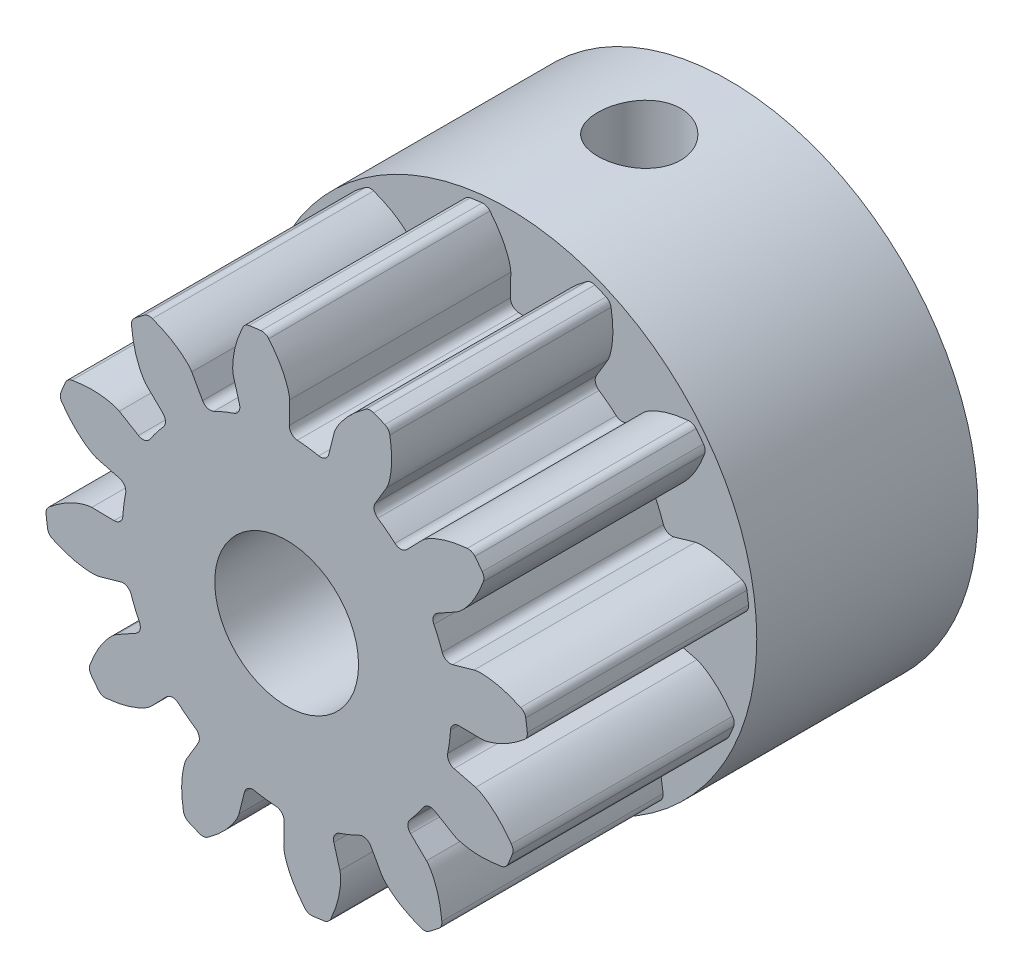
from build123d import *

# Parameters (mm, degrees)
EXTRUDE_1_DEPTH                 = 8
SKETCH_2_R                      = 9
EXTRUDE_2_DEPTH                 = 8
SKETCH_3_R                      = 2.6
CUT_EXTRUDE_1_DEPTH             = 21.445048388
SKETCH_4_W                      = 5.6
SKETCH_4_H                      = 2.6
CUT_EXTRUDE_2_DEPTH             = 6.5
CUT_EXTRUDE_3_REACH             = 19.501
SKETCH_5_R                      = 1.5
CUT_EXTRUDE_3_DIRECTION_2_DEPTH = 18.50114299


with BuildPart() as part:
    # 草图1 → 凸台-拉伸1 (new body)
    with BuildSketch(Plane.XY):
        with BuildLine():
            Line((1.721923819, 6.834104062), (1.525117566, 6.053004226))
            ThreePointArc((1.525117566, 6.053004226), (1.389032317, 5.865185287), (1.160983915, 5.822887823))
            ThreePointArc((1.160983915, 5.822887823), (0.968517342, 5.857975794), (0.774999266, 5.886703864))
            ThreePointArc((0.774999266, 5.886703864), (0.580639788, 5.909040843), (0.385649919, 5.92496248))
            ThreePointArc((0.385649919, 5.92496248), (0.176319467, 6.024841963), (0.093482328, 6.241482581))
            Line((0.093482328, 6.241482581), (0.105545599, 7.046904291))
            add(Edge.make_bspline(
                [(-0.649249674, 8.585993084), (-0.541014516, 8.451424341), (-0.326461552, 8.174265446), (-0.09406722, 7.754050995), (0.041682677, 7.397285398), (0.096816454, 7.173786834), (0.10379949, 7.072284874), (0.105545599, 7.046904291)],
                knots=[0.168803506, 0.168803506, 0.168803506, 0.168803506, 0.686224826, 1.219956542, 1.601195732, 1.829944144, 1.906214021, 1.906214021, 1.906214021, 1.906214021], degree=3))
            ThreePointArc((-0.649249674, 8.585993084), (-0.772877087, 8.678727408), (-0.925823343, 8.700882205))
            ThreePointArc((-0.925823343, 8.700882205), (-1.142104182, 8.675142537), (-1.357677346, 8.644027546))
            ThreePointArc((-1.357677346, 8.644027546), (-1.499678001, 8.583042252), (-1.595091504, 8.461470645))
            add(Edge.make_bspline(
                [(-1.595091504, 8.461470645), (-1.664809685, 8.3034739), (-1.800317933, 7.980228573), (-1.916034117, 7.514184503), (-1.954820718, 7.134440739), (-1.950230172, 6.904288033), (-1.930704626, 6.804437326), (-1.92582226, 6.779469639)],
                knots=[0.168803506, 0.168803506, 0.168803506, 0.168803506, 0.686224826, 1.219956542, 1.601195732, 1.829944144, 1.906214021, 1.906214021, 1.906214021, 1.906214021], degree=3))
            Line((-1.92582226, 6.779469639), (-1.705711557, 6.004614212))
            ThreePointArc((-1.705711557, 6.004614212), (-1.729655371, 5.773915615), (-1.906002348, 5.623260736))
            ThreePointArc((-1.906002348, 5.623260736), (-2.090227275, 5.557414524), (-2.27218288, 5.485534724))
            ThreePointArc((-2.27218288, 5.485534724), (-2.451671615, 5.407699376), (-2.628498613, 5.323992984))
            ThreePointArc((-2.628498613, 5.323992984), (-2.859723843, 5.305825927), (-3.039783219, 5.452023636))
            Line((-3.039783219, 5.452023636), (-3.432046975, 6.155570934))
            add(Edge.make_bspline(
                [(-4.855263253, 7.111063291), (-4.694244485, 7.04864092), (-4.369856721, 6.915890758), (-3.9584901, 6.668171534), (-3.662544441, 6.427078412), (-3.503047908, 6.261089867), (-3.446249442, 6.176678109), (-3.432046975, 6.155570934)],
                knots=[0.168803506, 0.168803506, 0.168803506, 0.168803506, 0.686224826, 1.219956542, 1.601195732, 1.829944144, 1.906214021, 1.906214021, 1.906214021, 1.906214021], degree=3))
            ThreePointArc((-4.855263253, 7.111063291), (-5.008694895, 7.129559864), (-5.152227636, 7.072273353))
            ThreePointArc((-5.152227636, 7.072273353), (-5.326662504, 6.941841728), (-5.497796845, 6.807108773))
            ThreePointArc((-5.497796845, 6.807108773), (-5.590280373, 6.683293632), (-5.612125086, 6.53030278))
            add(Edge.make_bspline(
                [(-5.612125086, 6.53030278), (-5.593504429, 6.358614495), (-5.549235351, 6.010921706), (-5.416426471, 5.54945761), (-5.260144771, 5.201196563), (-5.141092888, 5.004173746), (-5.074257916, 4.92746327), (-5.05754582, 4.908281802)],
                knots=[0.168803506, 0.168803506, 0.168803506, 0.168803506, 0.686224826, 1.219956542, 1.601195732, 1.829944144, 1.906214021, 1.906214021, 1.906214021, 1.906214021], degree=3))
            Line((-5.05754582, 4.908281802), (-4.479496646, 4.347292669))
            ThreePointArc((-4.479496646, 4.347292669), (-4.384883298, 4.135529916), (-4.462276821, 3.916885475))
            ThreePointArc((-4.462276821, 3.916885475), (-4.588897182, 3.767748519), (-4.710535458, 3.614520985))
            ThreePointArc((-4.710535458, 3.614520985), (-4.827059588, 3.457369228), (-4.938343065, 3.296463867))
            ThreePointArc((-4.938343065, 3.296463867), (-5.12950646, 3.165118119), (-5.358541308, 3.201699361))
            Line((-5.358541308, 3.201699361), (-6.050025334, 3.614857316))
            add(Edge.make_bspline(
                [(-7.760312965, 3.730729831), (-7.589655435, 3.757179856), (-7.24235231, 3.804408726), (-6.762238754, 3.795560895), (-6.385395735, 3.734740956), (-6.164273412, 3.670738926), (-6.072878619, 3.626035432), (-6.050025334, 3.614857316)],
                knots=[0.168803506, 0.168803506, 0.168803506, 0.168803506, 0.686224826, 1.219956542, 1.601195732, 1.829944144, 1.906214021, 1.906214021, 1.906214021, 1.906214021], degree=3))
            ThreePointArc((-7.760312965, 3.730729831), (-7.902436951, 3.670032512), (-7.998096696, 3.548654568))
            ThreePointArc((-7.998096696, 3.548654568), (-8.083945909, 3.348480033), (-8.164786119, 3.146230701))
            ThreePointArc((-8.164786119, 3.146230701), (-8.182971633, 2.992761879), (-8.125394284, 2.849345559))
            add(Edge.make_bspline(
                [(-8.125394284, 2.849345559), (-8.02342418, 2.709969471), (-7.811239638, 2.430993222), (-7.465491726, 2.097758032), (-7.156017281, 1.874295968), (-6.954403917, 1.763195144), (-6.858167896, 1.73017941), (-6.834104062, 1.721923819)],
                knots=[0.168803506, 0.168803506, 0.168803506, 0.168803506, 0.686224826, 1.219956542, 1.601195732, 1.829944144, 1.906214021, 1.906214021, 1.906214021, 1.906214021], degree=3))
            Line((-6.834104062, 1.721923819), (-6.053004226, 1.525117566))
            ThreePointArc((-6.053004226, 1.525117566), (-5.865185287, 1.389032317), (-5.822887823, 1.160983915))
            ThreePointArc((-5.822887823, 1.160983915), (-5.857975794, 0.968517342), (-5.886703864, 0.774999266))
            ThreePointArc((-5.886703864, 0.774999266), (-5.909040843, 0.580639788), (-5.92496248, 0.385649919))
            ThreePointArc((-5.92496248, 0.385649919), (-6.024841963, 0.176319467), (-6.241482581, 0.093482328))
            Line((-6.241482581, 0.093482328), (-7.046904291, 0.105545599))
            add(Edge.make_bspline(
                [(-8.585993084, -0.649249674), (-8.451424341, -0.541014516), (-8.174265446, -0.326461552), (-7.754050995, -0.09406722), (-7.397285398, 0.041682677), (-7.173786834, 0.096816454), (-7.072284874, 0.10379949), (-7.046904291, 0.105545599)],
                knots=[0.168803506, 0.168803506, 0.168803506, 0.168803506, 0.686224826, 1.219956542, 1.601195732, 1.829944144, 1.906214021, 1.906214021, 1.906214021, 1.906214021], degree=3))
            ThreePointArc((-8.585993084, -0.649249674), (-8.678727408, -0.772877087), (-8.700882205, -0.925823343))
            ThreePointArc((-8.700882205, -0.925823343), (-8.675142537, -1.142104182), (-8.644027546, -1.357677346))
            ThreePointArc((-8.644027546, -1.357677346), (-8.583042252, -1.499678001), (-8.461470645, -1.595091504))
            add(Edge.make_bspline(
                [(-8.461470645, -1.595091504), (-8.3034739, -1.664809685), (-7.980228573, -1.800317933), (-7.514184503, -1.916034117), (-7.134440739, -1.954820718), (-6.904288033, -1.950230172), (-6.804437326, -1.930704626), (-6.779469639, -1.92582226)],
                knots=[0.168803506, 0.168803506, 0.168803506, 0.168803506, 0.686224826, 1.219956542, 1.601195732, 1.829944144, 1.906214021, 1.906214021, 1.906214021, 1.906214021], degree=3))
            Line((-6.779469639, -1.92582226), (-6.004614212, -1.705711557))
            ThreePointArc((-6.004614212, -1.705711557), (-5.773915615, -1.729655371), (-5.623260736, -1.906002348))
            ThreePointArc((-5.623260736, -1.906002348), (-5.557414524, -2.090227275), (-5.485534724, -2.27218288))
            ThreePointArc((-5.485534724, -2.27218288), (-5.407699376, -2.451671615), (-5.323992984, -2.628498613))
            ThreePointArc((-5.323992984, -2.628498613), (-5.305825927, -2.859723843), (-5.452023636, -3.039783219))
            Line((-5.452023636, -3.039783219), (-6.155570934, -3.432046975))
            add(Edge.make_bspline(
                [(-7.111063291, -4.855263253), (-7.04864092, -4.694244485), (-6.915890758, -4.369856721), (-6.668171534, -3.9584901), (-6.427078412, -3.662544441), (-6.261089867, -3.503047908), (-6.176678109, -3.446249442), (-6.155570934, -3.432046975)],
                knots=[0.168803506, 0.168803506, 0.168803506, 0.168803506, 0.686224826, 1.219956542, 1.601195732, 1.829944144, 1.906214021, 1.906214021, 1.906214021, 1.906214021], degree=3))
            ThreePointArc((-7.111063291, -4.855263253), (-7.129559864, -5.008694895), (-7.072273353, -5.152227636))
            ThreePointArc((-7.072273353, -5.152227636), (-6.941841728, -5.326662504), (-6.807108773, -5.497796845))
            ThreePointArc((-6.807108773, -5.497796845), (-6.683293632, -5.590280373), (-6.53030278, -5.612125086))
            add(Edge.make_bspline(
                [(-6.53030278, -5.612125086), (-6.358614495, -5.593504429), (-6.010921706, -5.549235351), (-5.54945761, -5.416426471), (-5.201196563, -5.260144771), (-5.004173746, -5.141092888), (-4.92746327, -5.074257916), (-4.908281802, -5.05754582)],
                knots=[0.168803506, 0.168803506, 0.168803506, 0.168803506, 0.686224826, 1.219956542, 1.601195732, 1.829944144, 1.906214021, 1.906214021, 1.906214021, 1.906214021], degree=3))
            Line((-4.908281802, -5.05754582), (-4.347292669, -4.479496646))
            ThreePointArc((-4.347292669, -4.479496646), (-4.135529916, -4.384883298), (-3.916885475, -4.462276821))
            ThreePointArc((-3.916885475, -4.462276821), (-3.767748519, -4.588897182), (-3.614520985, -4.710535458))
            ThreePointArc((-3.614520985, -4.710535458), (-3.457369228, -4.827059588), (-3.296463867, -4.938343065))
            ThreePointArc((-3.296463867, -4.938343065), (-3.165118119, -5.12950646), (-3.201699361, -5.358541308))
            Line((-3.201699361, -5.358541308), (-3.614857316, -6.050025334))
            add(Edge.make_bspline(
                [(-3.730729831, -7.760312965), (-3.757179856, -7.589655435), (-3.804408726, -7.24235231), (-3.795560895, -6.762238754), (-3.734740956, -6.385395735), (-3.670738926, -6.164273412), (-3.626035432, -6.072878619), (-3.614857316, -6.050025334)],
                knots=[0.168803506, 0.168803506, 0.168803506, 0.168803506, 0.686224826, 1.219956542, 1.601195732, 1.829944144, 1.906214021, 1.906214021, 1.906214021, 1.906214021], degree=3))
            ThreePointArc((-3.730729831, -7.760312965), (-3.670032512, -7.902436951), (-3.548654568, -7.998096696))
            ThreePointArc((-3.548654568, -7.998096696), (-3.348480033, -8.083945909), (-3.146230701, -8.164786119))
            ThreePointArc((-3.146230701, -8.164786119), (-2.992761879, -8.182971633), (-2.849345559, -8.125394284))
            add(Edge.make_bspline(
                [(-2.849345559, -8.125394284), (-2.709969471, -8.02342418), (-2.430993222, -7.811239638), (-2.097758032, -7.465491726), (-1.874295968, -7.156017281), (-1.763195144, -6.954403917), (-1.73017941, -6.858167896), (-1.721923819, -6.834104062)],
                knots=[0.168803506, 0.168803506, 0.168803506, 0.168803506, 0.686224826, 1.219956542, 1.601195732, 1.829944144, 1.906214021, 1.906214021, 1.906214021, 1.906214021], degree=3))
            Line((-1.721923819, -6.834104062), (-1.525117566, -6.053004226))
            ThreePointArc((-1.525117566, -6.053004226), (-1.389032316, -5.865185287), (-1.160983915, -5.822887823))
            ThreePointArc((-1.160983915, -5.822887823), (-0.968517342, -5.857975794), (-0.774999266, -5.886703864))
            ThreePointArc((-0.774999266, -5.886703864), (-0.580639788, -5.909040843), (-0.385649919, -5.92496248))
            ThreePointArc((-0.385649919, -5.92496248), (-0.176319467, -6.024841963), (-0.093482328, -6.241482581))
            Line((-0.093482328, -6.241482581), (-0.105545599, -7.046904291))
            add(Edge.make_bspline(
                [(0.649249674, -8.585993084), (0.541014516, -8.451424341), (0.326461552, -8.174265446), (0.09406722, -7.754050995), (-0.041682677, -7.397285398), (-0.096816454, -7.173786834), (-0.10379949, -7.072284874), (-0.105545599, -7.046904291)],
                knots=[0.168803506, 0.168803506, 0.168803506, 0.168803506, 0.686224826, 1.219956542, 1.601195732, 1.829944144, 1.906214021, 1.906214021, 1.906214021, 1.906214021], degree=3))
            ThreePointArc((0.649249674, -8.585993084), (0.772877087, -8.678727408), (0.925823343, -8.700882205))
            ThreePointArc((0.925823343, -8.700882205), (1.142104182, -8.675142537), (1.357677346, -8.644027546))
            ThreePointArc((1.357677346, -8.644027546), (1.499678001, -8.583042252), (1.595091504, -8.461470645))
            add(Edge.make_bspline(
                [(1.595091504, -8.461470645), (1.664809685, -8.3034739), (1.800317933, -7.980228573), (1.916034117, -7.514184503), (1.954820718, -7.134440739), (1.950230172, -6.904288033), (1.930704626, -6.804437326), (1.92582226, -6.779469639)],
                knots=[0.168803506, 0.168803506, 0.168803506, 0.168803506, 0.686224826, 1.219956542, 1.601195732, 1.829944144, 1.906214021, 1.906214021, 1.906214021, 1.906214021], degree=3))
            Line((1.92582226, -6.779469639), (1.705711557, -6.004614212))
            ThreePointArc((1.705711557, -6.004614212), (1.729655371, -5.773915615), (1.906002348, -5.623260736))
            ThreePointArc((1.906002348, -5.623260736), (2.090227275, -5.557414524), (2.27218288, -5.485534724))
            ThreePointArc((2.27218288, -5.485534724), (2.451671615, -5.407699376), (2.628498613, -5.323992984))
            ThreePointArc((2.628498613, -5.323992984), (2.859723843, -5.305825927), (3.039783219, -5.452023636))
            Line((3.039783219, -5.452023636), (3.432046975, -6.155570934))
            add(Edge.make_bspline(
                [(4.855263253, -7.111063291), (4.694244485, -7.04864092), (4.369856721, -6.915890758), (3.9584901, -6.668171534), (3.662544441, -6.427078412), (3.503047908, -6.261089867), (3.446249442, -6.176678109), (3.432046975, -6.155570934)],
                knots=[0.168803506, 0.168803506, 0.168803506, 0.168803506, 0.686224826, 1.219956542, 1.601195732, 1.829944144, 1.906214021, 1.906214021, 1.906214021, 1.906214021], degree=3))
            ThreePointArc((4.855263253, -7.111063291), (5.008694896, -7.129559864), (5.152227637, -7.072273353))
            ThreePointArc((5.152227637, -7.072273353), (5.326662504, -6.941841728), (5.497796845, -6.807108773))
            ThreePointArc((5.497796845, -6.807108773), (5.590280373, -6.683293632), (5.612125086, -6.53030278))
            add(Edge.make_bspline(
                [(5.612125086, -6.53030278), (5.593504429, -6.358614495), (5.549235351, -6.010921706), (5.416426471, -5.54945761), (5.260144771, -5.201196563), (5.141092888, -5.004173746), (5.074257916, -4.92746327), (5.05754582, -4.908281802)],
                knots=[0.168803506, 0.168803506, 0.168803506, 0.168803506, 0.686224826, 1.219956542, 1.601195732, 1.829944144, 1.906214021, 1.906214021, 1.906214021, 1.906214021], degree=3))
            Line((5.05754582, -4.908281802), (4.479496646, -4.347292669))
            ThreePointArc((4.479496646, -4.347292669), (4.384883298, -4.135529916), (4.462276821, -3.916885475))
            ThreePointArc((4.462276821, -3.916885475), (4.588897182, -3.767748519), (4.710535458, -3.614520985))
            ThreePointArc((4.710535458, -3.614520985), (4.827059588, -3.457369228), (4.938343065, -3.296463867))
            ThreePointArc((4.938343065, -3.296463867), (5.12950646, -3.165118119), (5.358541308, -3.201699361))
            Line((5.358541308, -3.201699361), (6.050025334, -3.614857316))
            add(Edge.make_bspline(
                [(7.760312965, -3.730729831), (7.589655435, -3.757179856), (7.24235231, -3.804408726), (6.762238754, -3.795560895), (6.385395735, -3.734740956), (6.164273412, -3.670738926), (6.072878619, -3.626035432), (6.050025334, -3.614857316)],
                knots=[0.168803506, 0.168803506, 0.168803506, 0.168803506, 0.686224826, 1.219956542, 1.601195732, 1.829944144, 1.906214021, 1.906214021, 1.906214021, 1.906214021], degree=3))
            ThreePointArc((7.760312965, -3.730729831), (7.902436951, -3.670032512), (7.998096696, -3.548654568))
            ThreePointArc((7.998096696, -3.548654568), (8.083945909, -3.348480033), (8.164786119, -3.146230701))
            ThreePointArc((8.164786119, -3.146230701), (8.182971633, -2.99276188), (8.125394284, -2.849345559))
            add(Edge.make_bspline(
                [(8.125394284, -2.849345559), (8.02342418, -2.709969471), (7.811239638, -2.430993222), (7.465491726, -2.097758032), (7.156017281, -1.874295968), (6.954403917, -1.763195144), (6.858167896, -1.73017941), (6.834104062, -1.721923819)],
                knots=[0.168803506, 0.168803506, 0.168803506, 0.168803506, 0.686224826, 1.219956542, 1.601195732, 1.829944144, 1.906214021, 1.906214021, 1.906214021, 1.906214021], degree=3))
            Line((6.834104062, -1.721923819), (6.053004226, -1.525117566))
            ThreePointArc((6.053004226, -1.525117566), (5.865185287, -1.389032317), (5.822887823, -1.160983915))
            ThreePointArc((5.822887823, -1.160983915), (5.857975794, -0.968517342), (5.886703864, -0.774999266))
            ThreePointArc((5.886703864, -0.774999266), (5.909040843, -0.580639788), (5.92496248, -0.385649919))
            ThreePointArc((5.92496248, -0.385649919), (6.024841963, -0.176319467), (6.241482581, -0.093482328))
            Line((6.241482581, -0.093482328), (7.046904291, -0.105545599))
            add(Edge.make_bspline(
                [(8.585993084, 0.649249674), (8.451424341, 0.541014516), (8.174265446, 0.326461552), (7.754050995, 0.09406722), (7.397285398, -0.041682677), (7.173786834, -0.096816454), (7.072284874, -0.10379949), (7.046904291, -0.105545599)],
                knots=[0.168803506, 0.168803506, 0.168803506, 0.168803506, 0.686224826, 1.219956542, 1.601195732, 1.829944144, 1.906214021, 1.906214021, 1.906214021, 1.906214021], degree=3))
            ThreePointArc((8.585993084, 0.649249674), (8.678727408, 0.772877087), (8.700882205, 0.925823343))
            ThreePointArc((8.700882205, 0.925823343), (8.675142537, 1.142104182), (8.644027546, 1.357677346))
            ThreePointArc((8.644027546, 1.357677346), (8.583042252, 1.499678001), (8.461470645, 1.595091504))
            add(Edge.make_bspline(
                [(8.461470645, 1.595091504), (8.3034739, 1.664809685), (7.980228573, 1.800317933), (7.514184503, 1.916034117), (7.134440739, 1.954820718), (6.904288033, 1.950230172), (6.804437326, 1.930704626), (6.779469639, 1.92582226)],
                knots=[0.168803506, 0.168803506, 0.168803506, 0.168803506, 0.686224826, 1.219956542, 1.601195732, 1.829944144, 1.906214021, 1.906214021, 1.906214021, 1.906214021], degree=3))
            Line((6.779469639, 1.92582226), (6.004614212, 1.705711557))
            ThreePointArc((6.004614212, 1.705711557), (5.773915615, 1.729655371), (5.623260736, 1.906002348))
            ThreePointArc((5.623260736, 1.906002348), (5.557414524, 2.090227275), (5.485534724, 2.27218288))
            ThreePointArc((5.485534724, 2.27218288), (5.407699376, 2.451671615), (5.323992984, 2.628498613))
            ThreePointArc((5.323992984, 2.628498613), (5.305825927, 2.859723843), (5.452023636, 3.039783219))
            Line((5.452023636, 3.039783219), (6.155570934, 3.432046975))
            add(Edge.make_bspline(
                [(7.111063291, 4.855263253), (7.04864092, 4.694244485), (6.915890758, 4.369856721), (6.668171534, 3.9584901), (6.427078412, 3.662544441), (6.261089867, 3.503047908), (6.176678109, 3.446249442), (6.155570934, 3.432046975)],
                knots=[0.168803506, 0.168803506, 0.168803506, 0.168803506, 0.686224826, 1.219956542, 1.601195732, 1.829944144, 1.906214021, 1.906214021, 1.906214021, 1.906214021], degree=3))
            ThreePointArc((7.111063291, 4.855263253), (7.129559864, 5.008694895), (7.072273353, 5.152227636))
            ThreePointArc((7.072273353, 5.152227636), (6.941841728, 5.326662504), (6.807108773, 5.497796845))
            ThreePointArc((6.807108773, 5.497796845), (6.683293632, 5.590280373), (6.53030278, 5.612125086))
            add(Edge.make_bspline(
                [(6.53030278, 5.612125086), (6.358614495, 5.593504429), (6.010921706, 5.549235351), (5.54945761, 5.416426471), (5.201196563, 5.260144771), (5.004173746, 5.141092888), (4.92746327, 5.074257916), (4.908281802, 5.05754582)],
                knots=[0.168803506, 0.168803506, 0.168803506, 0.168803506, 0.686224826, 1.219956542, 1.601195732, 1.829944144, 1.906214021, 1.906214021, 1.906214021, 1.906214021], degree=3))
            Line((4.908281802, 5.05754582), (4.347292669, 4.479496646))
            ThreePointArc((4.347292669, 4.479496646), (4.135529916, 4.384883298), (3.916885475, 4.462276821))
            ThreePointArc((3.916885475, 4.462276821), (3.767748519, 4.588897182), (3.614520985, 4.710535458))
            ThreePointArc((3.614520985, 4.710535458), (3.457369228, 4.827059588), (3.296463867, 4.938343065))
            ThreePointArc((3.296463867, 4.938343065), (3.165118119, 5.12950646), (3.201699361, 5.358541308))
            Line((3.201699361, 5.358541308), (3.614857316, 6.050025334))
            add(Edge.make_bspline(
                [(3.730729831, 7.760312965), (3.757179856, 7.589655435), (3.804408726, 7.24235231), (3.795560895, 6.762238754), (3.734740956, 6.385395735), (3.670738926, 6.164273412), (3.626035432, 6.072878619), (3.614857316, 6.050025334)],
                knots=[0.168803506, 0.168803506, 0.168803506, 0.168803506, 0.686224826, 1.219956542, 1.601195732, 1.829944144, 1.906214021, 1.906214021, 1.906214021, 1.906214021], degree=3))
            ThreePointArc((3.730729831, 7.760312965), (3.670032512, 7.902436951), (3.548654568, 7.998096696))
            ThreePointArc((3.548654568, 7.998096696), (3.348480033, 8.083945909), (3.146230701, 8.164786119))
            ThreePointArc((3.146230701, 8.164786119), (2.99276188, 8.182971633), (2.849345559, 8.125394284))
            add(Edge.make_bspline(
                [(2.849345559, 8.125394284), (2.709969471, 8.02342418), (2.430993222, 7.811239638), (2.097758032, 7.465491726), (1.874295968, 7.156017281), (1.763195144, 6.954403917), (1.73017941, 6.858167896), (1.721923819, 6.834104062)],
                knots=[0.168803506, 0.168803506, 0.168803506, 0.168803506, 0.686224826, 1.219956542, 1.601195732, 1.829944144, 1.906214021, 1.906214021, 1.906214021, 1.906214021], degree=3))
        make_face()
    extrude(amount=EXTRUDE_1_DEPTH)

    # 草图2 → 凸台-拉伸2 (add)
    with BuildSketch(Plane(origin=(0, 0, 0), x_dir=(-1, 0, 0), z_dir=(0, 0, -1))):
        Circle(SKETCH_2_R)
    extrude(amount=EXTRUDE_2_DEPTH)

    # 草图3 → 切除-拉伸1 (cut, through all)
    with BuildSketch(Plane.XY.offset(8)):
        Circle(SKETCH_3_R)
    extrude(amount=-CUT_EXTRUDE_1_DEPTH, mode=Mode.SUBTRACT)

    # 草图4 → 切除-拉伸2 (cut)
    with BuildSketch(Plane(origin=(0, 0, -8), x_dir=(-1, 0, 0), z_dir=(0, 0, -1))):
        with Locations((0, 5)):
            Rectangle(SKETCH_4_W, SKETCH_4_H)
    extrude(amount=-CUT_EXTRUDE_2_DEPTH, mode=Mode.SUBTRACT)

    # 草图5 → 切除-拉伸3 (cut, up to next)
    with BuildSketch(Plane(origin=(0, 3.7, 0), x_dir=(1, 0, 0), z_dir=(0, 1, 0)), mode=Mode.PRIVATE) as cut_extrude_3_sk1:
        with Locations(Location((0, 4.75, 0), (0, 0, 90))):
            Circle(SKETCH_5_R)
    cut_extrude_3_tool1 = extrude(cut_extrude_3_sk1.sketch, amount=-CUT_EXTRUDE_3_REACH, mode=Mode.PRIVATE) & part.part
    add(cut_extrude_3_tool1.solids().sort_by_distance((0, 3.7, -4.75))[0], mode=Mode.SUBTRACT)

    # 草图5 → 切除-拉伸3 direction 2 (cut)
    with BuildSketch(Plane(origin=(0, 3.7, 0), x_dir=(1, 0, 0), z_dir=(0, 1, 0))):
        with Locations(Location((0, 4.75, 0), (0, 0, 90))):
            Circle(SKETCH_5_R)
    extrude(amount=CUT_EXTRUDE_3_DIRECTION_2_DEPTH, mode=Mode.SUBTRACT)


solid = part.part
